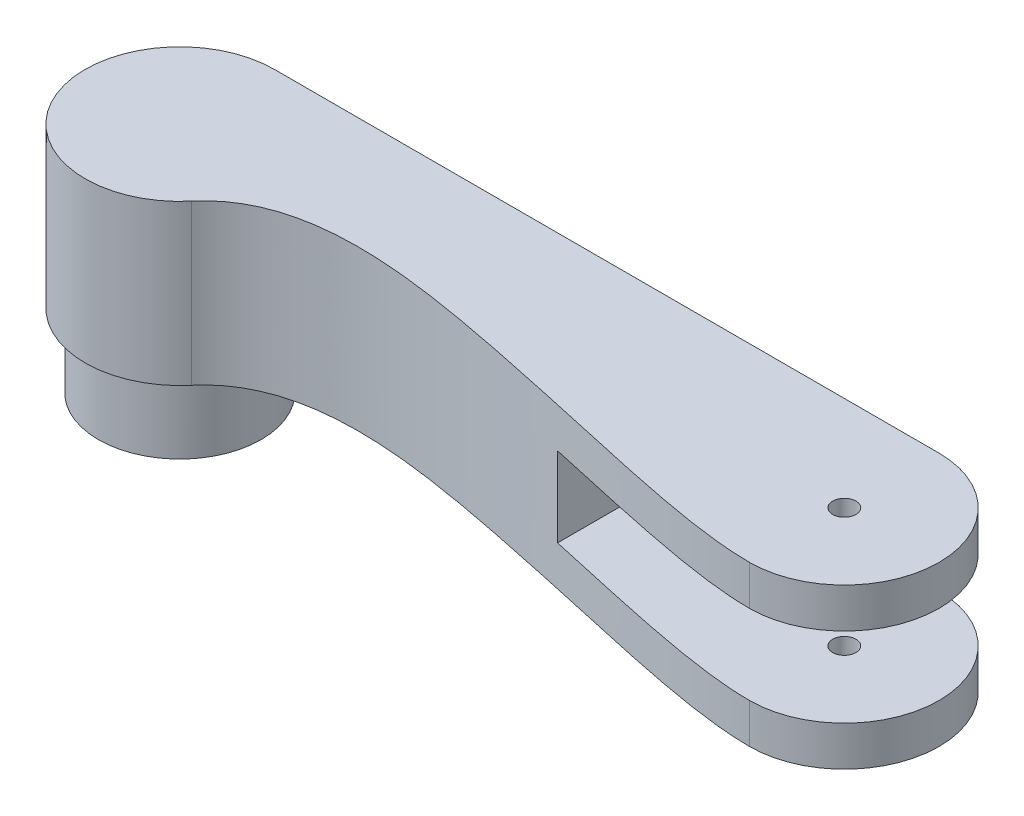
from build123d import *

# Parameters (mm, degrees)
BOSS_EXTRUDE1_DEPTH = 6
SKETCH3_R           = 1.75
CUT_EXTRUDE2_DEPTH  = 67.08422656
BOSS_EXTRUDE2_DEPTH = 12
BOSS_EXTRUDE3_DEPTH = 6
CUT_EXTRUDE3_REACH  = 72.051
SKETCH6_R           = 1.75
CUT_EXTRUDE4_REACH  = 72.051
SKETCH8_R           = 12.25
BOSS_EXTRUDE4_DEPTH = 11
SKETCH9_R           = 2.55
SKETCH9_R_2         = 3
CUT_EXTRUDE5_DEPTH  = 6


with BuildPart() as part:
    # Sketch1 → Boss-Extrude1 (new body)
    with BuildSketch(Plane(origin=(0, 0, 0), x_dir=(1, 0, 0), z_dir=(0, 1, 0))):
        with BuildLine():
            Line((-50, 14.25), (50, 14.25))
            ThreePointArc((50, 14.25), (64.25, 0), (50, -14.25))
            Line((50, -14.25), (-50, -14.25))
            ThreePointArc((-50, -14.25), (-64.25, 0), (-50, 14.25))
        make_face()
    extrude(amount=BOSS_EXTRUDE1_DEPTH)

    # Sketch3 → Cut-Extrude2 (cut, through all)
    with BuildSketch(Plane.XZ):
        with Locations(Location((50, 0, 0), (0, 0, 270))):
            Circle(SKETCH3_R)
    extrude(amount=-CUT_EXTRUDE2_DEPTH, mode=Mode.SUBTRACT)

    # Sketch4 → Boss-Extrude2 (add)
    with BuildSketch(Plane(origin=(0, 6, 0), x_dir=(1, 0, 0), z_dir=(0, 1, 0))):
        with BuildLine():
            Line((-50, 14.25), (15, 14.25))
            Line((15, 14.25), (15, -14.25))
            Line((15, -14.25), (-50, -14.25))
            ThreePointArc((-50, -14.25), (-64.25, 0), (-50, 14.25))
        make_face()
    extrude(amount=BOSS_EXTRUDE2_DEPTH)

    # Sketch5 → Boss-Extrude3 (add)
    with BuildSketch(Plane(origin=(0, 18, 0), x_dir=(1, 0, 0), z_dir=(0, 1, 0))):
        with BuildLine():
            Line((-50, 14.25), (50, 14.25))
            ThreePointArc((50, 14.25), (64.25, 0), (50, -14.25))
            Line((50, -14.25), (-50, -14.25))
            ThreePointArc((-50, -14.25), (-64.25, 0), (-50, 14.25))
        make_face()
    extrude(amount=BOSS_EXTRUDE3_DEPTH)

    # Sketch6 → Cut-Extrude3 (cut, up to next)
    with BuildSketch(Plane(origin=(0, 24, 0), x_dir=(1, 0, 0), z_dir=(0, 1, 0)), mode=Mode.PRIVATE) as cut_extrude3_sk1:
        with Locations(Location((50, 0, 0), (0, 0, 90))):
            Circle(SKETCH6_R)
    cut_extrude3_tool1 = extrude(cut_extrude3_sk1.sketch, amount=-CUT_EXTRUDE3_REACH, mode=Mode.PRIVATE) & part.part
    add(cut_extrude3_tool1.solids().sort_by_distance((50, 24, 0))[0], mode=Mode.SUBTRACT)

    # Sketch7 → Cut-Extrude4 (cut, up to next)
    with BuildSketch(Plane(origin=(0, 24, 0), x_dir=(1, 0, 0), z_dir=(0, 1, 0)), mode=Mode.PRIVATE) as cut_extrude4_sk1:
        with BuildLine():
            ThreePointArc((-39.07315683, -9.146944754), (-43.970135273, -12.911360555), (-50, -14.25))
            Line((-50, -14.25), (50, -14.25))
            add(Edge.make_bspline(
                [(-39.07315683, -9.146944754), (-31.514094033, -0.116968526), (5.438655837, -4.645240543), (38.697514387, -14.25), (50, -14.25)],
                knots=[0, 0, 0, 0, 0.435907903, 1, 1, 1, 1], degree=3))
        make_face()
    cut_extrude4_tool1 = extrude(cut_extrude4_sk1.sketch, amount=-CUT_EXTRUDE4_REACH, mode=Mode.PRIVATE) & part.part
    add(cut_extrude4_tool1.solids().sort_by_distance((-8.590717, 24, 9.791359))[0], mode=Mode.SUBTRACT)

    # Sketch8 → Boss-Extrude4 (add)
    with BuildSketch(Plane.XZ):
        with Locations(Location((-50, 0, 0), (0, 0, 90))):
            Circle(SKETCH8_R)
    extrude(amount=BOSS_EXTRUDE4_DEPTH)

    # Sketch9 → Cut-Extrude5 (cut)
    with BuildSketch(Plane.XZ.offset(11)):
        with Locations(Location((-50, 6.75, 0), (0, 0, 270))):
            Circle(SKETCH9_R)
        with Locations(Location((-50, -6.75, 0), (0, 0, 270))):
            Circle(SKETCH9_R)
        with Locations(Location((-50, 0, 0), (0, 0, 270))):
            Circle(SKETCH9_R_2)
    extrude(amount=-CUT_EXTRUDE5_DEPTH, mode=Mode.SUBTRACT)


solid = part.part
